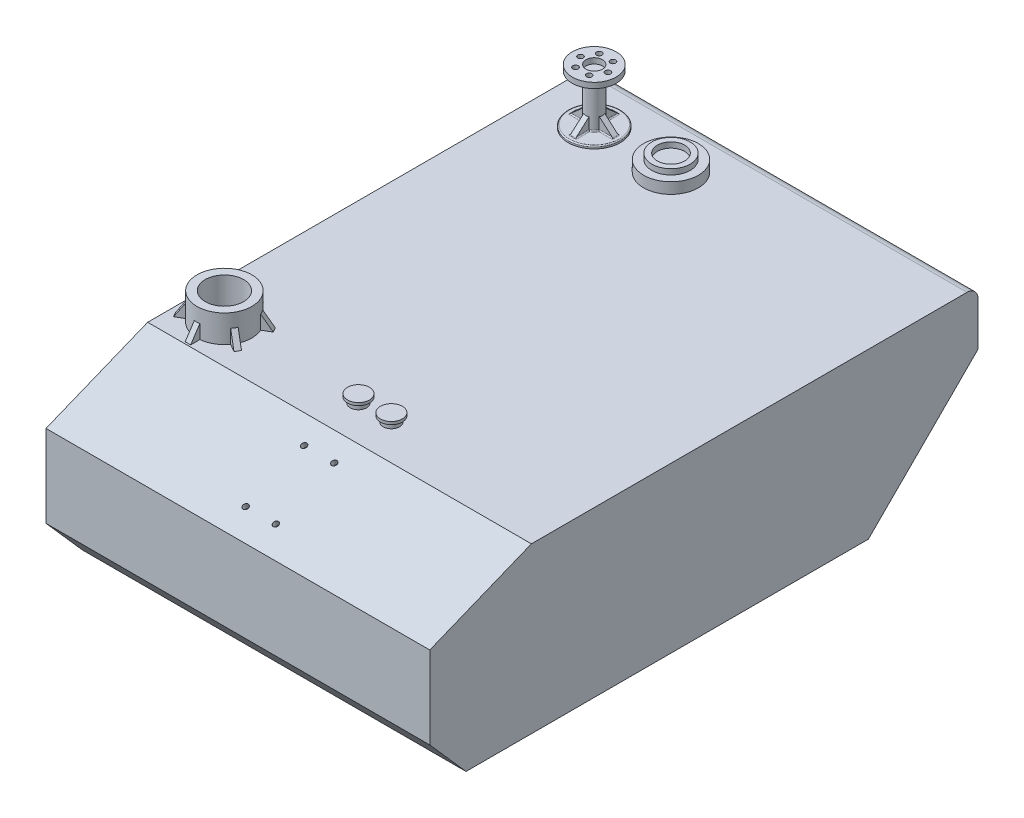
from build123d import *

# Parameters (mm, degrees)
SKETCH2_W           = 700
SKETCH2_H           = 1000
BOSS_EXTRUDE1_DEPTH = 300
SKETCH3_R           = 15
BOSS_EXTRUDE2_DEPTH = 100
CUT_EXTRUDE2_DEPTH  = 949.683298051
CUT_EXTRUDE3_DEPTH  = 949.683298051
CUT_EXTRUDE4_DEPTH  = 949.683298051
FILLET1_R           = 20
SKETCH8_R           = 40
BOSS_EXTRUDE3_DEPTH = 10
SKETCH10_R          = 15
CUT_EXTRUDE5_DEPTH  = 20
SKETCH11_R          = 5
CUT_EXTRUDE6_DEPTH  = 10
RIB6_REACH          = 879.496
SKETCH13_WALL_W     = 1796.992877478
SKETCH13_WALL_H     = 10
CIRPATTERN1_COUNT   = 4
SKETCH14_R          = 47.5
BOSS_EXTRUDE4_DEPTH = 5
FILLET2_R           = 2
SKETCH15_R          = 50
BOSS_EXTRUDE5_DEPTH = 20
SKETCH16_R          = 35
BOSS_EXTRUDE6_DEPTH = 10
SKETCH17_R          = 25
CUT_EXTRUDE7_DEPTH  = 10
SKETCH18_R          = 50
SKETCH18_R_2        = 35
BOSS_EXTRUDE7_DEPTH = 50
RIB7_REACH          = 900.276
SKETCH19_WALL_W     = 1828.552253624
SKETCH19_WALL_H     = 10
CIRPATTERN2_COUNT   = 6
SKETCH20_R          = 15
BOSS_EXTRUDE8_DEPTH = 10
SKETCH21_R          = 20
BOSS_EXTRUDE9_DEPTH = 5
SKETCH22_R          = 5
CUT_EXTRUDE8_DEPTH  = 10


with BuildPart() as part:
    # Sketch2 → Boss-Extrude1 (new body)
    with BuildSketch(Plane(origin=(0, 0, 0), x_dir=(1, 0, 0), z_dir=(0, 1, 0))):
        Rectangle(SKETCH2_W, SKETCH2_H)
    extrude(amount=BOSS_EXTRUDE1_DEPTH)

    # Sketch3 → Boss-Extrude2 (add)
    with BuildSketch(Plane(origin=(0, 300, 0), x_dir=(1, 0, 0), z_dir=(0, 1, 0))):
        with Locations(Location((-250, 400, 0), (0, 0, 90))):
            Circle(SKETCH3_R)
    extrude(amount=BOSS_EXTRUDE2_DEPTH)

    # Sketch5 → Cut-Extrude2 (cut, through all)
    with BuildSketch(Plane.ZY.offset(350)):
        Polygon((314.595037823, 300), (500, 300), (500, 225), align=None)
    extrude(amount=-CUT_EXTRUDE2_DEPTH, mode=Mode.SUBTRACT)

    # Sketch6 → Cut-Extrude3 (cut, through all)
    with BuildSketch(Plane.ZY.offset(350)):
        Polygon((433.856217223, 0), (500, 75), (500, 0), align=None)
    extrude(amount=-CUT_EXTRUDE3_DEPTH, mode=Mode.SUBTRACT)

    # Sketch7 → Cut-Extrude4 (cut, through all)
    with BuildSketch(Plane.ZY.offset(350)):
        Polygon((-500, 200), (-300, 0), (-500, 0), align=None)
    extrude(amount=-CUT_EXTRUDE4_DEPTH, mode=Mode.SUBTRACT)

    # Fillet1
    fillet1_edges = [part.edges().sort_by_distance(p)[0] for p in [
        (0, 300, -500),
    ]]
    fillet(fillet1_edges, radius=FILLET1_R)

    # Sketch8 → Boss-Extrude3 (add)
    with BuildSketch(Plane(origin=(0, 400, 0), x_dir=(1, 0, 0), z_dir=(0, 1, 0))):
        with Locations(Location((-250, 400, 0), (0, 0, 270))):
            Circle(SKETCH8_R)
    extrude(amount=-BOSS_EXTRUDE3_DEPTH)

    # Sketch10 → Cut-Extrude5 (cut)
    with BuildSketch(Plane(origin=(0, 390, 0), x_dir=(-1, 0, 0), z_dir=(0, -1, 0))):
        with Locations(Location((250, 400, 0), (0, 0, 90))):
            Circle(SKETCH10_R)
    extrude(amount=-CUT_EXTRUDE5_DEPTH, mode=Mode.SUBTRACT)


with BuildPart() as cut_extrude5_piece_1:
    # of the separate pieces the step leaves, piece 1, a body of its own (cut_extrude5_pieces)
    add(part.part.solids().sort_by_distance((-350, 280, -500))[0])

    # Sketch13 wall → Rib6 (add, up to next)
    with BuildSketch(Plane(origin=(-250, 313.228756556, -370), x_dir=(0, -0.661437827771, 0.749999999996), z_dir=(0, -0.749999999996, -0.661437827771)), mode=Mode.PRIVATE) as rib6_sk1:
        Rectangle(SKETCH13_WALL_W, SKETCH13_WALL_H)
    rib6_tool1 = extrude(rib6_sk1.sketch, amount=RIB6_REACH, mode=Mode.PRIVATE) - cut_extrude5_piece_1.part
    rib6 = rib6_tool1.solids().sort_by_distance((-250, 313.228756556, -370))[0]
    add(rib6)

    # CirPattern1: Rib6 ×4 about axis
    cirpattern1_axis = Axis((-250, 0, -400), (0, 1, 0))
    for i in range(1, CIRPATTERN1_COUNT):
        add(rib6.rotate(cirpattern1_axis, i * 360 / CIRPATTERN1_COUNT))

    # Sketch14 → Boss-Extrude4 (add)
    with BuildSketch(Plane(origin=(0, 300, 0), x_dir=(1, 0, 0), z_dir=(0, 1, 0))):
        with Locations(Location((-250, 400, 0), (0, 0, 90))):
            Circle(SKETCH14_R)
    extrude(amount=BOSS_EXTRUDE4_DEPTH)

    # Fillet2
    fillet2_edges = [cut_extrude5_piece_1.edges().sort_by_distance(p)[0] for p in [
        (-276.736334265, 305, -395),
        (-239.393398282, 305, -410.606601718),
        (-245, 305, -426.736334265),
        (-260.606601718, 305, -410.606601718),
        (-276.736334265, 305, -405),
        (-260.606601718, 305, -389.393398282),
        (-255, 305, -373.263665735),
        (-239.393398282, 305, -389.393398282),
        (-223.263665735, 305, -395),
        (-223.263665735, 305, -405),
        (-210.669467094, 305, -400),
        (-245, 305, -373.263665735),
        (-250, 305, -360.669467094),
        (-289.330532906, 305, -400),
        (-255, 305, -426.736334265),
        (-250, 305, -439.330532906),
        (-250, 305, -352.5),
    ]]
    fillet(fillet2_edges, radius=FILLET2_R)

    # Sketch15 → Boss-Extrude5 (add)
    with BuildSketch(Plane(origin=(0, 300, 0), x_dir=(1, 0, 0), z_dir=(0, 1, 0))):
        with Locations(Location((-110, 400, 0), (0, 0, 90))):
            Circle(SKETCH15_R)
    extrude(amount=BOSS_EXTRUDE5_DEPTH)

    # Sketch16 → Boss-Extrude6 (add)
    with BuildSketch(Plane(origin=(0, 320, 0), x_dir=(1, 0, 0), z_dir=(0, 1, 0))):
        with Locations(Location((-110, 400, 0), (0, 0, 270))):
            Circle(SKETCH16_R)
    extrude(amount=BOSS_EXTRUDE6_DEPTH)

    # Sketch17 → Cut-Extrude7 (cut)
    with BuildSketch(Plane(origin=(0, 330, 0), x_dir=(1, 0, 0), z_dir=(0, 1, 0))):
        with Locations(Location((-110, 400, 0), (0, 0, 270))):
            Circle(SKETCH17_R)
    extrude(amount=-CUT_EXTRUDE7_DEPTH, mode=Mode.SUBTRACT)

    # Sketch18 → Boss-Extrude7 (add)
    with BuildSketch(Plane(origin=(0, 300, 0), x_dir=(1, 0, 0), z_dir=(0, 1, 0))):
        with Locations(Location((-280, -244.595037823, 0), (0, 0, 90))):
            Circle(SKETCH18_R)
        with Locations(Location((-280, -244.595037823, 0), (0, 0, 270))):
            Circle(SKETCH18_R_2, mode=Mode.SUBTRACT)
    extrude(amount=BOSS_EXTRUDE7_DEPTH)

    # Sketch19 wall → Rib7 (add, up to next)
    with BuildSketch(Plane(origin=(-280, 312.5, 302.886599799), x_dir=(0, -0.833333333345, 0.552770798375), z_dir=(0, -0.552770798375, -0.833333333345)), mode=Mode.PRIVATE) as rib7_sk1:
        Rectangle(SKETCH19_WALL_W, SKETCH19_WALL_H)
    rib7_tool1 = extrude(rib7_sk1.sketch, amount=RIB7_REACH, mode=Mode.PRIVATE) - cut_extrude5_piece_1.part
    rib7 = rib7_tool1.solids().sort_by_distance((-280, 312.5, 302.886599799))[0]
    add(rib7)

    # CirPattern2: Rib7 ×6 about axis
    cirpattern2_axis = Axis((-280, 0, 244.595037823), (0, 1, 0))
    for i in range(1, CIRPATTERN2_COUNT):
        add(rib7.rotate(cirpattern2_axis, i * 360 / CIRPATTERN2_COUNT))

    # Sketch20 → Boss-Extrude8 (add, symmetric)
    with BuildSketch(Plane(origin=(0, 300, 0), x_dir=(1, 0, 0), z_dir=(0, 1, 0))):
        with Locations(Location((-30, -250, 0), (0, 0, 90))):
            Circle(SKETCH20_R)
        with Locations(Location((30, -250, 0), (0, 0, 90))):
            Circle(SKETCH20_R)
    extrude(amount=BOSS_EXTRUDE8_DEPTH, both=True)

    # Sketch21 → Boss-Extrude9 (add)
    with BuildSketch(Plane(origin=(0, 310, 0), x_dir=(1, 0, 0), z_dir=(0, 1, 0))):
        with Locations(Location((-30, -250, 0), (0, 0, 270))):
            Circle(SKETCH21_R)
        with Locations(Location((30, -250, 0), (0, 0, 270))):
            Circle(SKETCH21_R)
    extrude(amount=BOSS_EXTRUDE9_DEPTH)

    # Sketch22 → Cut-Extrude8 (cut)
    with BuildSketch(Plane(origin=(0, 367.176527041, 148.530218419), x_dir=(1, 0, 0), z_dir=(0, 0.927024810886958, 0.3749999999999998))):
        with Locations(Location((-27.5, -219.137405443, 0), (0, 0, 270))):
            Circle(SKETCH22_R)
        with Locations(Location((27.5, -219.137405443, 0), (0, 0, 270))):
            Circle(SKETCH22_R)
        with Locations(Location((27.5, -334.137405443, 0), (0, 0, 270))):
            Circle(SKETCH22_R)
        with Locations(Location((-27.5, -334.137405443, 0), (0, 0, 270))):
            Circle(SKETCH22_R)
    extrude(amount=-CUT_EXTRUDE8_DEPTH, mode=Mode.SUBTRACT)


with BuildPart() as cut_extrude5_piece_2:
    # of the separate pieces the step leaves, piece 2, a body of its own (cut_extrude5_pieces)
    add(part.part.solids().sort_by_distance((-250, 390, -360))[0])

    # Sketch11 → Cut-Extrude6 (cut)
    with BuildSketch(Plane(origin=(0, 390, 0), x_dir=(-1, 0, 0), z_dir=(0, -1, 0))):
        with Locations(Location((225, 400, 0), (0, 0, 90))):
            Circle(SKETCH11_R)
        with Locations(Location((237.5, 421.650635095, 0), (0, 0, 90))):
            Circle(SKETCH11_R)
        with Locations(Location((262.5, 421.650635095, 0), (0, 0, 90))):
            Circle(SKETCH11_R)
        with Locations(Location((275, 400, 0), (0, 0, 90))):
            Circle(SKETCH11_R)
        with Locations(Location((262.5, 378.349364905, 0), (0, 0, 90))):
            Circle(SKETCH11_R)
        with Locations(Location((237.5, 378.349364905, 0), (0, 0, 90))):
            Circle(SKETCH11_R)
    extrude(amount=-CUT_EXTRUDE6_DEPTH, mode=Mode.SUBTRACT)


solid = Compound([cut_extrude5_piece_1.part, cut_extrude5_piece_2.part])
